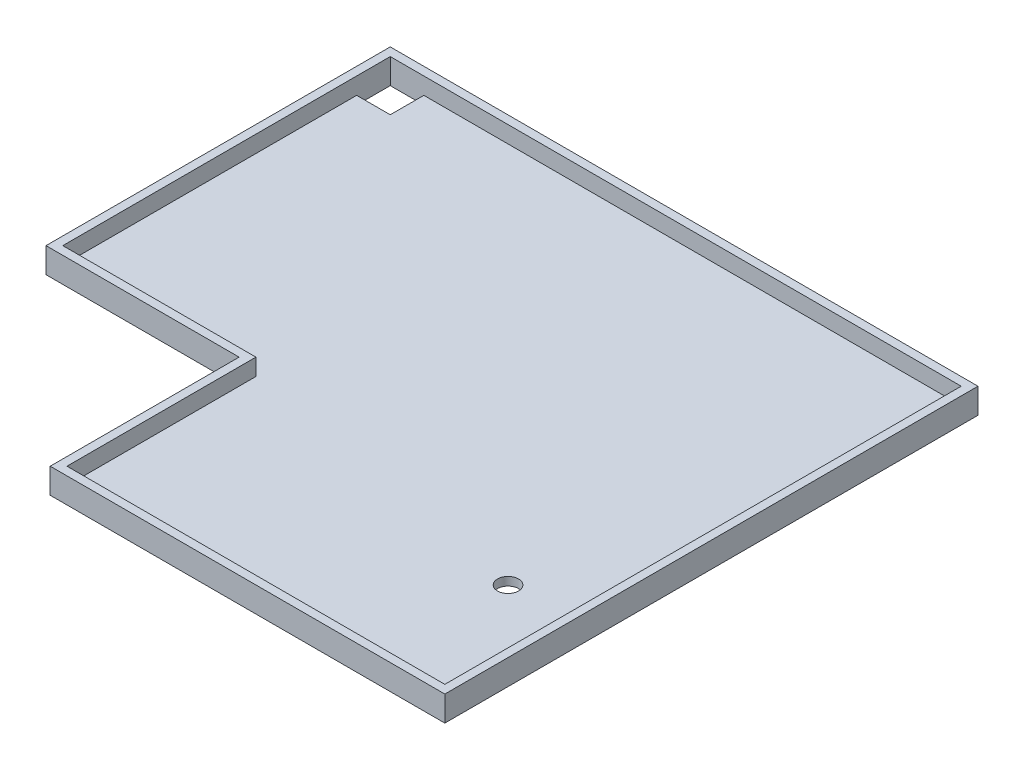
from build123d import *

# Parameters (mm, degrees)
BOSS_EXTRUDE1_DEPTH = 3
CUT_EXTRUDE2_START  = 1
CUT_EXTRUDE2_DEPTH  = 55.91287866
SKETCH2_R           = 1.25
CUT_EXTRUDE3_DEPTH  = 56.868148349
CUT_EXTRUDE4_REACH  = 57.868
SKETCH3_W           = 4
SKETCH3_H           = 4


with BuildPart() as part:
    # Sketch1 → Boss-Extrude1 (new body)
    with BuildSketch(Plane(origin=(0, 0, 0), x_dir=(1, 0, 0), z_dir=(0, 1, 0))):
        Polygon((35, 20), (-35, 20), (-35, -21), (-12, -21), (-12, -43.5), (35, -43.5), align=None)
    extrude(amount=BOSS_EXTRUDE1_DEPTH)

    # Sketch1<6> → Cut-Extrude2 (cut, through all)
    with BuildSketch(Plane(origin=(0, 0, 0), x_dir=(1, 0, 0), z_dir=(0, 1, 0)).offset(CUT_EXTRUDE2_START)):
        Polygon((-34, 19), (-34, -18), (-34, -20), (-11, -20), (-11, -42.5), (34, -42.5), (34, -20), (34, -18), (34, 19), align=None)
    extrude(amount=CUT_EXTRUDE2_DEPTH, mode=Mode.SUBTRACT)

    # Sketch2 → Cut-Extrude3 (cut, through all)
    with BuildSketch(Plane(origin=(0, 1, 0), x_dir=(1, 0, 0), z_dir=(0, 1, 0))):
        with Locations((25.514070345, -26.486113073)):
            Circle(SKETCH2_R)
    extrude(amount=-CUT_EXTRUDE3_DEPTH, mode=Mode.SUBTRACT)

    # Sketch3 → Cut-Extrude4 (cut, up to next)
    with BuildSketch(Plane(origin=(0, 1, 0), x_dir=(1, 0, 0), z_dir=(0, 1, 0)), mode=Mode.PRIVATE) as cut_extrude4_sk1:
        with Locations((-32, 17)):
            Rectangle(SKETCH3_W, SKETCH3_H)
    cut_extrude4_tool1 = extrude(cut_extrude4_sk1.sketch, amount=-CUT_EXTRUDE4_REACH, mode=Mode.PRIVATE) & part.part
    add(cut_extrude4_tool1.solids().sort_by_distance((-32, 1, -17))[0], mode=Mode.SUBTRACT)


solid = part.part
